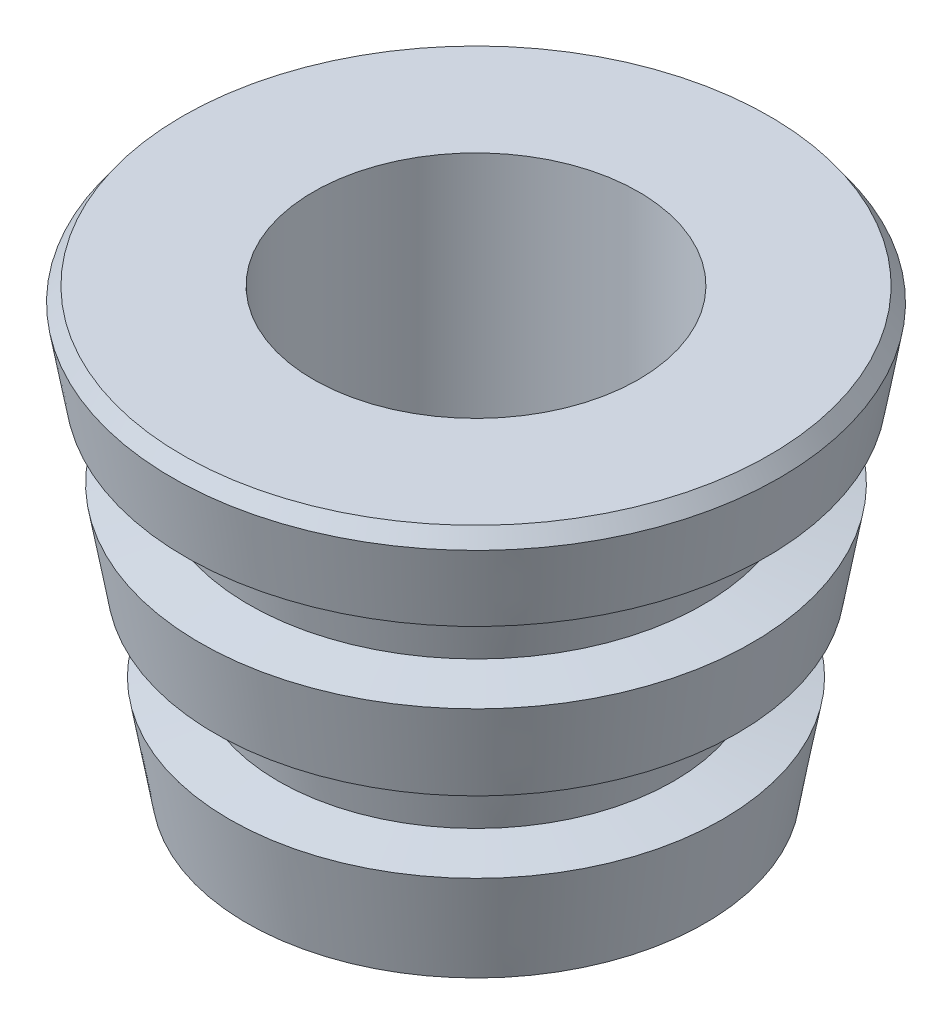
from build123d import *

# Parameters (mm, degrees)
SMUSSO2_SIZE             = 0.5
SMUSSO2_SIZE2            = 0.431608995
SCHIZZO6_R               = 5.5
TAGLIO_ESTRUSIONE1_DEPTH = 21.738887755


with BuildPart() as part:
    # Schizzo1 → Rivoluzione1 (revolve)
    with BuildSketch(Plane.XY):
        Polygon((0, -14.8), (-7.75, -14.8), (-10.359639314, 0), (0, 0), align=None)
    revolve(axis=Axis((0, 0, 0), (0, -1, 0)))

    # Schizzo2 → Taglia-Rivoluzione1 (revolve, cut)
    with BuildSketch(Plane.XY):
        Polygon((-9.824143265, -3.03694901), (-8.16966624, -2.745220072), (-7.683451342, -5.50268178), (-9.337928368, -5.794410718), align=None)
        Polygon((-8.824143265, -8.70823083), (-8.337928368, -11.465692538), (-6.683451342, -11.1739636), (-7.16966624, -8.416501891), align=None)
    revolve(axis=Axis((0, 0, 0), (0, -1, 0)), mode=Mode.SUBTRACT)

    # Smusso2
    smusso2_edges = [part.edges().sort_by_distance(p)[0] for p in [
        (10.359639314, 0, 0),
    ]]
    smusso2_side = [part.faces().sort_by_distance(p)[0] for p in [
        (10.09189129, -1.518474505, 0),
    ]]
    chamfer(smusso2_edges, length=SMUSSO2_SIZE, length2=SMUSSO2_SIZE2, reference=smusso2_side[0])

    # Schizzo6 → Taglio-Estrusione1 (cut, through all)
    with BuildSketch(Plane.XZ.offset(14.8)):
        Circle(SCHIZZO6_R)
    extrude(amount=-TAGLIO_ESTRUSIONE1_DEPTH, mode=Mode.SUBTRACT)


solid = part.part
